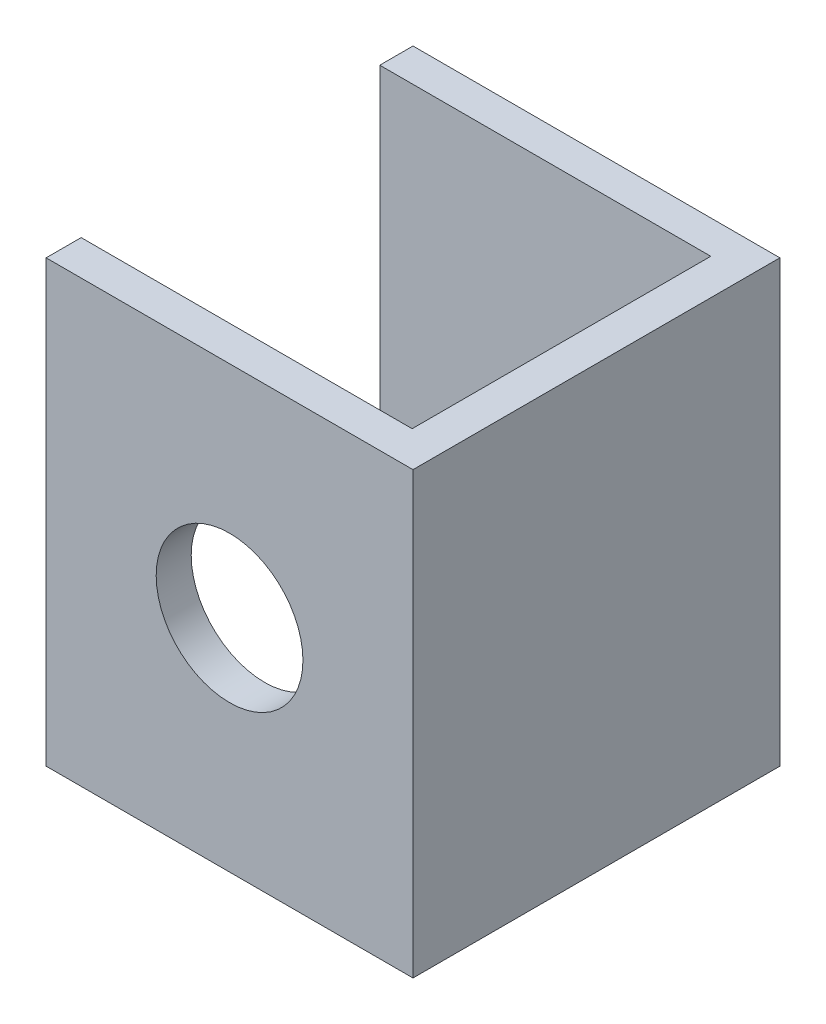
from build123d import *

# Parameters (mm, degrees)
SKETCH3_W           = 63.5
SKETCH3_H           = 76.2
BOSS_EXTRUDE1_DEPTH = 63.5
SKETCH20_W          = 57.288750963
SKETCH20_H          = 51.688361778
CUT_EXTRUDE2_DEPTH  = 106.747278632
SKETCH21_R          = 12.7
CUT_EXTRUDE4_DEPTH  = 6.063211567


with BuildPart() as part:
    # Sketch3 → Boss-Extrude1 (new body)
    with BuildSketch(Plane(origin=(0, 0, 0), x_dir=(0, 0, -1), z_dir=(1, 0, 0))):
        with Locations((-4.90783597, -0.71667611)):
            Rectangle(SKETCH3_W, SKETCH3_H)
    extrude(amount=BOSS_EXTRUDE1_DEPTH)

    # Sketch20 → Cut-Extrude2 (cut, through all)
    with BuildSketch(Plane(origin=(0, -38.81667611, 0), x_dir=(-1, 0, 0), z_dir=(0, -1, 0))):
        with Locations((-28.644375482, -4.750443514)):
            Rectangle(SKETCH20_W, SKETCH20_H)
    extrude(amount=-CUT_EXTRUDE2_DEPTH, mode=Mode.SUBTRACT)

    # Sketch21 → Cut-Extrude4 (cut)
    with BuildSketch(Plane.XY.offset(36.65783597)):
        with Locations((31.75, -0.71667611)):
            Circle(SKETCH21_R)
    extrude(amount=-CUT_EXTRUDE4_DEPTH, mode=Mode.SUBTRACT)


solid = part.part
